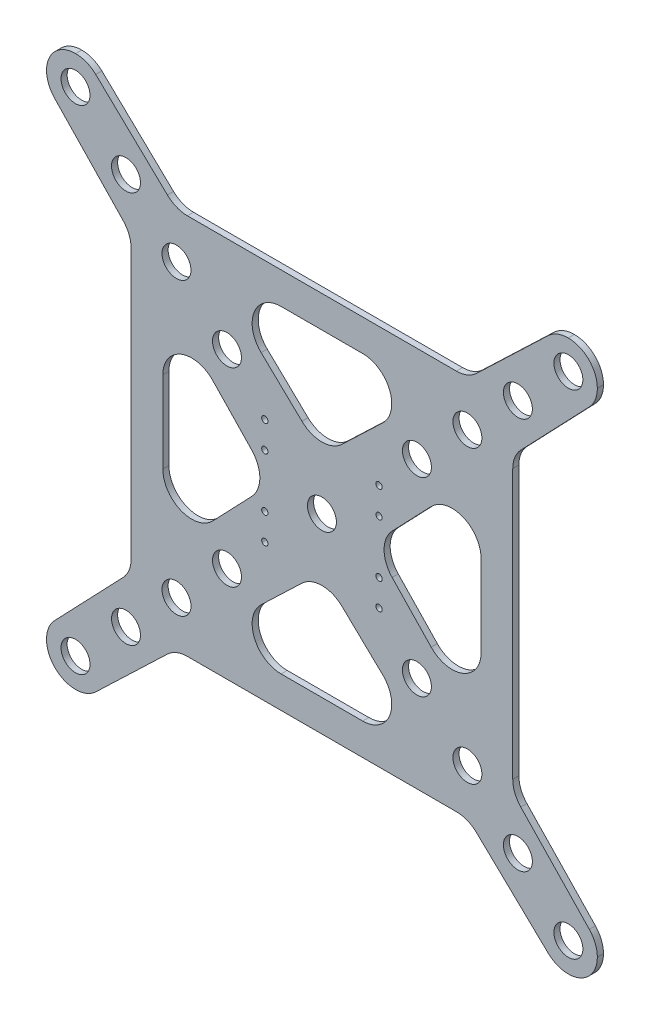
from build123d import *

# Parameters (mm, degrees)
SKETCH1_W               = 270
SKETCH1_H               = 270
SKETCH1_R               = 7.1
BOSS_EXTRUDE1_DEPTH     = 3
SKETCH2_R               = 1.55
CUT_EXTRUDE1_DEPTH      = 191.942399692
CUT_EXTRUDE2_DEPTH      = 191.942399692
CUT_EXTRUDE2_DEPTH_BACK = 191.942399692
FILLET1_R               = 14.2


with BuildPart() as part:
    # Sketch1 → Boss-Extrude1 (new body)
    with BuildSketch(Plane.XY):
        Rectangle(SKETCH1_W, SKETCH1_H)
        Circle(SKETCH1_R, mode=Mode.SUBTRACT)
        with Locations((-120.8, 120.8)):
            Circle(SKETCH1_R, mode=Mode.SUBTRACT)
        with Locations(Location((-120.8, -120.8, 0), (0, 0, 180))):
            Circle(SKETCH1_R, mode=Mode.SUBTRACT)
        with Locations((120.8, -120.8)):
            Circle(SKETCH1_R, mode=Mode.SUBTRACT)
        with Locations(Location((120.8, 120.8, 0), (0, 0, 180))):
            Circle(SKETCH1_R, mode=Mode.SUBTRACT)
        with Locations((-96.051262658, 96.051262658)):
            Circle(SKETCH1_R, mode=Mode.SUBTRACT)
        with Locations((-71.302525317, 71.302525317)):
            Circle(SKETCH1_R, mode=Mode.SUBTRACT)
        with Locations((-46.553787975, 46.553787975)):
            Circle(SKETCH1_R, mode=Mode.SUBTRACT)
        with Locations(Location((46.553787975, 46.553787975, 0), (0, 0, 180))):
            Circle(SKETCH1_R, mode=Mode.SUBTRACT)
        with Locations(Location((71.302525317, 71.302525317, 0), (0, 0, 180))):
            Circle(SKETCH1_R, mode=Mode.SUBTRACT)
        with Locations(Location((96.051262658, 96.051262658, 0), (0, 0, 180))):
            Circle(SKETCH1_R, mode=Mode.SUBTRACT)
        with Locations((96.051262658, -96.051262658)):
            Circle(SKETCH1_R, mode=Mode.SUBTRACT)
        with Locations((71.302525317, -71.302525317)):
            Circle(SKETCH1_R, mode=Mode.SUBTRACT)
        with Locations((46.553787975, -46.553787975)):
            Circle(SKETCH1_R, mode=Mode.SUBTRACT)
        with Locations(Location((-46.553787975, -46.553787975, 0), (0, 0, 180))):
            Circle(SKETCH1_R, mode=Mode.SUBTRACT)
        with Locations(Location((-71.302525317, -71.302525317, 0), (0, 0, 180))):
            Circle(SKETCH1_R, mode=Mode.SUBTRACT)
        with Locations(Location((-96.051262658, -96.051262658, 0), (0, 0, 180))):
            Circle(SKETCH1_R, mode=Mode.SUBTRACT)
    extrude(amount=BOSS_EXTRUDE1_DEPTH)

    # Sketch2 → Cut-Extrude1 (cut, symmetric)
    with BuildSketch(Plane.XY):
        with Locations((-28, 13)):
            Circle(SKETCH2_R)
        with Locations(Location((-28, -13, 0), (0, 0, 180))):
            Circle(SKETCH2_R)
        with Locations((-28, 26)):
            Circle(SKETCH2_R)
        with Locations(Location((-28, -26, 0), (0, 0, 180))):
            Circle(SKETCH2_R)
        with Locations((28, -26)):
            Circle(SKETCH2_R)
        with Locations(Location((28, 26, 0), (0, 0, 180))):
            Circle(SKETCH2_R)
    cut_extrude1 = extrude(amount=CUT_EXTRUDE1_DEPTH, both=True, mode=Mode.SUBTRACT)

    # Mirror1: Cut-Extrude1 across plane
    add(cut_extrude1.mirror(Plane(origin=(0, 0, 0), x_dir=(0, 0, 1), z_dir=(1, 0, 0))), mode=Mode.SUBTRACT)

    # Sketch4 → Cut-Extrude2 (cut, two sides: drawn at the far end of the back side and taken through both)
    with BuildSketch(Plane.XY.offset(-CUT_EXTRUDE2_DEPTH_BACK)):
        Polygon((-135, 115), (-93.526641242, 71.641488571), (-93.526641242, -71.641488571), (-135, -115), align=None)
        Polygon((115, 135), (-115, 135), (-71.641488571, 93.526641242), (71.641488571, 93.526641242), align=None)
        Polygon((135, -115), (135, 115), (93.526641242, 71.641488571), (93.526641242, -71.641488571), align=None)
        Polygon((115, -135), (71.641488571, -93.526641242), (-71.641488571, -93.526641242), (-115, -135), align=None)
        Polygon((-78, 55.409090909), (-78, -55.409090909), (-25, 0), align=None)
        Polygon((55.409090909, 78), (-55.409090909, 78), (0, 25), align=None)
        Polygon((78, -55.409090909), (78, 55.409090909), (25, 0), align=None)
        Polygon((-55.409090909, -78), (55.409090909, -78), (0, -25), align=None)
    extrude(amount=CUT_EXTRUDE2_DEPTH + CUT_EXTRUDE2_DEPTH_BACK, mode=Mode.SUBTRACT)

    # Fillet1
    fillet1_edges = [part.edges().sort_by_distance(p)[0] for p in [
        (93.526641242, 71.641488571, 1.5),
        (135, -115, 1.5),
        (135, 115, 1.5),
        (93.526641242, -71.641488571, 1.5),
        (0, 25, 1.5),
        (55.409090909, 78, 1.5),
        (-55.409090909, 78, 1.5),
        (-71.641488571, 93.526641242, 1.5),
        (115, 135, 1.5),
        (-115, 135, 1.5),
        (71.641488571, 93.526641242, 1.5),
        (-78, -55.409090909, 1.5),
        (-25, 0, 1.5),
        (-78, 55.409090909, 1.5),
        (0, -25, 1.5),
        (-55.409090909, -78, 1.5),
        (55.409090909, -78, 1.5),
        (-115, -135, 1.5),
        (71.641488571, -93.526641242, 1.5),
        (115, -135, 1.5),
        (-71.641488571, -93.526641242, 1.5),
        (25, 0, 1.5),
        (78, -55.409090909, 1.5),
        (78, 55.409090909, 1.5),
        (-135, 115, 1.5),
        (-93.526641242, -71.641488571, 1.5),
        (-135, -115, 1.5),
        (-93.526641242, 71.641488571, 1.5),
        (135, -135, 1.5),
        (-135, -135, 1.5),
        (-135, 135, 1.5),
        (135, 135, 1.5),
    ]]
    fillet(fillet1_edges, radius=FILLET1_R)


solid = part.part
